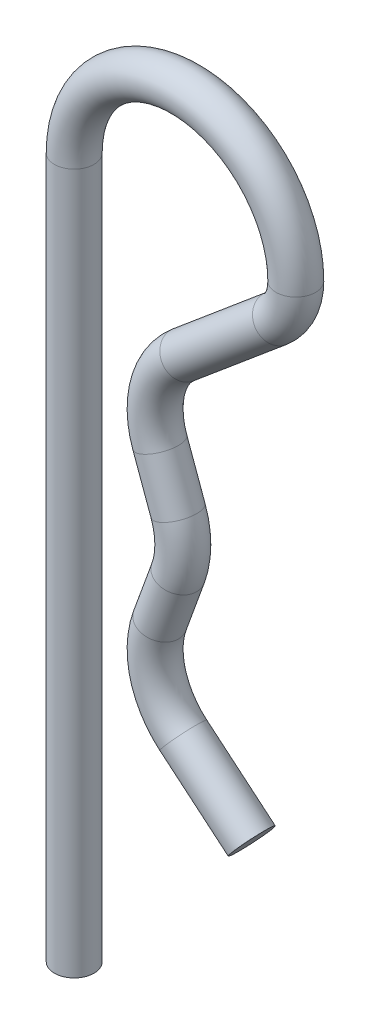
from build123d import *

# Parameters (mm, degrees)
SZKIC1_R = 2.5


with BuildPart() as part:
    # Wyciągnięcie po ścieżce1: sweep along a path in Szkic2
    with BuildLine(Plane.XY) as wyci_gni_cie_po_cie_ce1_path:
        Line((20.821502931, -29.975890373), (12.185665565, -22.729562424))
        ThreePointArc((12.185665565, -22.729562424), (8.146437857, -16.389244949), (8.474352926, -8.878755094))
        Line((8.474352926, -8.878755094), (10.77231686, -2.565151075))
        ThreePointArc((10.77231686, -2.565151075), (11.224622204, 0), (10.77231686, 2.565151075))
        Line((10.77231686, 2.565151075), (8.474352926, 8.878755094))
        ThreePointArc((8.474352926, 8.878755094), (8.146437857, 16.389244949), (12.185665565, 22.729562424))
        Line((12.185665565, 22.729562424), (23.892544244, 32.552800006))
        ThreePointArc((23.892544244, 32.552800006), (25.078385042, 34.098217822), (25.5, 36))
        ThreePointArc((25.5, 36), (14, 47.5), (2.5, 36))
        Line((2.5, 36), (2.5, -52.5))
    # Szkic1 → Wyciągnięcie po ścieżce1 (sweep)
    with BuildSketch(Plane(origin=(0, -52.5, 0), x_dir=(1, 0, 0), z_dir=(0, 1, 0))):
        Circle(SZKIC1_R)
    sweep(path=wyci_gni_cie_po_cie_ce1_path.line)


solid = part.part
